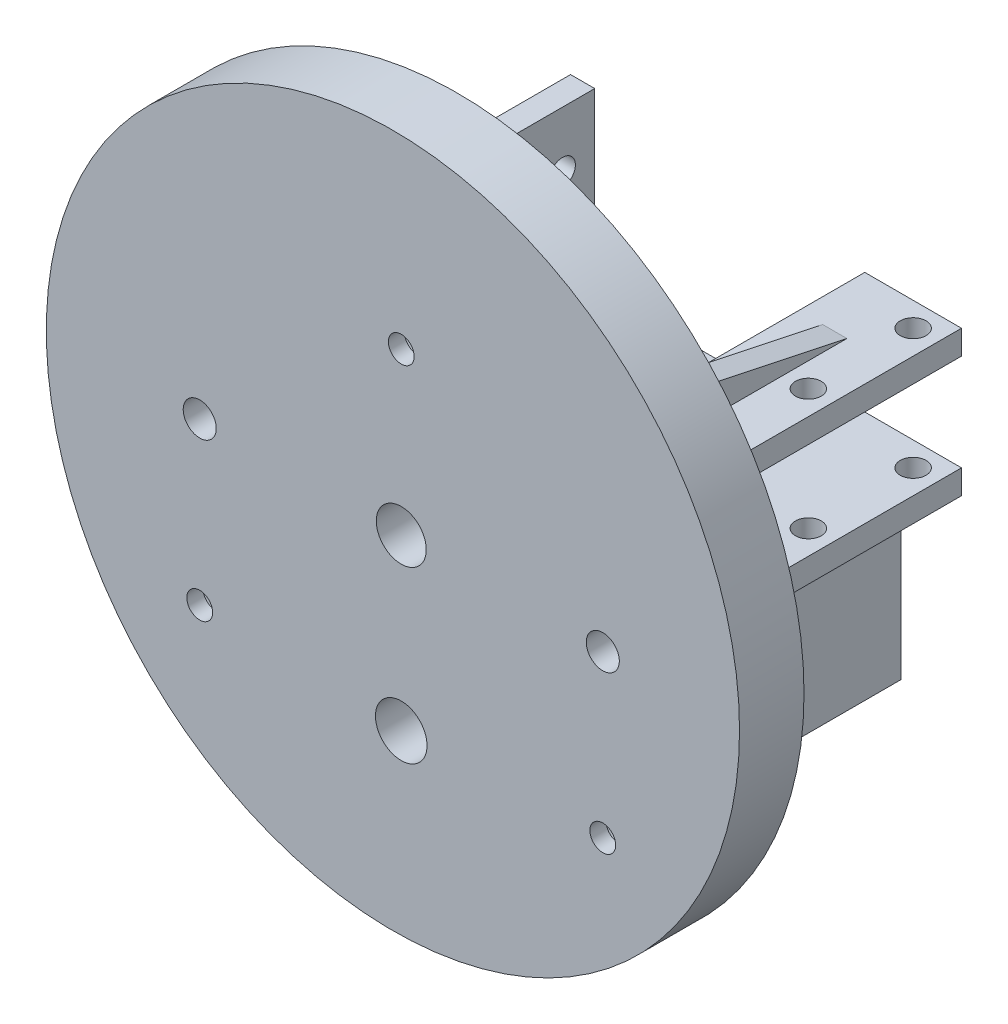
from build123d import *

# Parameters (mm, degrees)
SKETCH_1_R           = 21.5
EXTRUDE_1_DEPTH      = 4
SKETCH_2_R           = 1.55
CUT_EXTRUDE_1_DEPTH  = 32.032845297
SKETCH_3_R           = 1.025
CUT_EXTRUDE_4_DEPTH  = 32.032845297
SKETCH_3_3_R         = 2.5
CUT_EXTRUDE_5_DEPTH  = 3
SKETCH_4_R           = 0.8
CUT_EXTRUDE_6_DEPTH  = 32.032845297
SKETCH_5_R           = 1.6
CUT_EXTRUDE_7_DEPTH  = 32.032845297
CHAMFER_1_SIZE       = 0.5
SKETCH_6_W           = 14
SKETCH_6_H           = 11.5
SKETCH_6_W_2         = 12.5
SKETCH_6_H_2         = 10
EXTRUDE_2_DEPTH      = 20
CUT_EXTRUDE_8_DEPTH  = 49.060898735
SKETCH_9_W           = 1.5
SKETCH_9_H           = 13
SKETCH_9_H_2         = 6
EXTRUDE_3_DEPTH      = 16
SKETCH_10_R          = 0.8
CUT_EXTRUDE_9_DEPTH  = 48.343316459
SKETCH_11_W          = 6
SKETCH_11_H          = 1.5
EXTRUDE_4_DEPTH      = 20
SKETCH_12_R          = 0.8
CUT_EXTRUDE_10_DEPTH = 40.50680305
RIB_12_REACH         = 38.702
SKETCH_19_WALL_W     = 86.599014246
SKETCH_19_WALL_H     = 3
RIB_14_REACH         = 38.702
SKETCH_22_WALL_W     = 86.153478968
SKETCH_22_WALL_H     = 6
RIB_44_REACH         = 43.283
SKETCH_24_WALL_W     = 100.8135827
SKETCH_24_WALL_H     = 1.5
RIB_46_REACH         = 43.283
SKETCH_25_WALL_W     = 104.02522593
SKETCH_25_WALL_H     = 1


with BuildPart() as part:
    # 草图1 → 凸台-拉伸1 (new body)
    with BuildSketch(Plane.XY):
        with Locations((-0.517890163, 0)):
            Circle(SKETCH_1_R)
    extrude(amount=EXTRUDE_1_DEPTH)

    # 草图2 → 切除-拉伸1 (cut, through all)
    with BuildSketch(Plane(origin=(0, 0, 0), x_dir=(-1, 0, 0), z_dir=(0, 0, -1))):
        Circle(SKETCH_2_R)
    extrude(amount=-CUT_EXTRUDE_1_DEPTH, mode=Mode.SUBTRACT)

    # 草图3 → 切除-拉伸4 (cut, through all)
    with BuildSketch(Plane(origin=(0, 0, 0), x_dir=(-1, 0, 0), z_dir=(0, 0, -1))):
        with Locations((12.5, 0)):
            Circle(SKETCH_3_R)
        with Locations((-12.5, 0)):
            Circle(SKETCH_3_R)
    extrude(amount=-CUT_EXTRUDE_4_DEPTH, mode=Mode.SUBTRACT)

    # 草图3<3> → 切除-拉伸5 (cut)
    with BuildSketch(Plane(origin=(0, 0, 0), x_dir=(-1, 0, 0), z_dir=(0, 0, -1))):
        with Locations((0, 10)):
            Circle(SKETCH_3_3_R)
        with Locations((12.5, -10)):
            Circle(SKETCH_3_3_R)
        with Locations(Location((-12.5, -10, 0), (0, 0, 180))):
            Circle(SKETCH_3_3_R)
    extrude(amount=-CUT_EXTRUDE_5_DEPTH, mode=Mode.SUBTRACT)

    # 草图4 → 切除-拉伸6 (cut, through all)
    with BuildSketch(Plane(origin=(0, 0, 0), x_dir=(-1, 0, 0), z_dir=(0, 0, -1))):
        with Locations((0, 10)):
            Circle(SKETCH_4_R)
        with Locations((-12.5, -10)):
            Circle(SKETCH_4_R)
        with Locations((12.5, -10)):
            Circle(SKETCH_4_R)
    extrude(amount=-CUT_EXTRUDE_6_DEPTH, mode=Mode.SUBTRACT)

    # 草图5 → 切除-拉伸7 (cut, through all)
    with BuildSketch(Plane(origin=(0, 0, 0), x_dir=(-1, 0, 0), z_dir=(0, 0, -1))):
        with Locations((0, -10.5)):
            Circle(SKETCH_5_R)
    extrude(amount=-CUT_EXTRUDE_7_DEPTH, mode=Mode.SUBTRACT)

    # 倒角1
    chamfer_1_edges = [part.edges().sort_by_distance(p)[0] for p in [
        (1.6, -10.5, 0),
    ]]
    chamfer(chamfer_1_edges, length=CHAMFER_1_SIZE)

    # 草图6 → 凸台-拉伸2 (add)
    with BuildSketch(Plane(origin=(0, 0, 0), x_dir=(-1, 0, 0), z_dir=(0, 0, -1))):
        with Locations((0, -10.5)):
            Rectangle(SKETCH_6_W, SKETCH_6_H)
        with Locations((0, -10.5)):
            Rectangle(SKETCH_6_W_2, SKETCH_6_H_2, mode=Mode.SUBTRACT)
    extrude(amount=EXTRUDE_2_DEPTH)

    # 草图8 → 切除-拉伸8 (cut, through all)
    with BuildSketch(Plane.XZ.offset(16.25)):
        with BuildLine():
            Line((-4.789423927, -3.486509961), (4.789423927, -3.486509961))
            ThreePointArc((4.789423927, -3.486509961), (6.129674245, -4.826760278), (4.789423927, -6.167010596))
            Line((4.789423927, -6.167010596), (-4.789423927, -6.167010596))
            ThreePointArc((-4.789423927, -6.167010596), (-6.129674245, -4.826760278), (-4.789423927, -3.486509961))
        make_face()
        with BuildLine():
            Line((-4.789423927, -9.486509961), (4.789423927, -9.486509961))
            ThreePointArc((4.789423927, -9.486509961), (6.129674245, -10.826760278), (4.789423927, -12.167010596))
            Line((4.789423927, -12.167010596), (-4.789423927, -12.167010596))
            ThreePointArc((-4.789423927, -12.167010596), (-6.129674245, -10.826760278), (-4.789423927, -9.486509961))
        make_face()
        with BuildLine():
            Line((-4.789423927, -15.486509961), (4.789423927, -15.486509961))
            ThreePointArc((4.789423927, -15.486509961), (6.129674245, -16.826760278), (4.789423927, -18.167010596))
            Line((4.789423927, -18.167010596), (-4.789423927, -18.167010596))
            ThreePointArc((-4.789423927, -18.167010596), (-6.129674245, -16.826760278), (-4.789423927, -15.486509961))
        make_face()
    extrude(amount=-CUT_EXTRUDE_8_DEPTH, mode=Mode.SUBTRACT)

    # 草图9 → 凸台-拉伸3 (add)
    with BuildSketch(Plane(origin=(0, 0, 0), x_dir=(-1, 0, 0), z_dir=(0, 0, -1))):
        with Locations((8.75, 3.5)):
            Rectangle(SKETCH_9_W, SKETCH_9_H)
        with Locations((15.404659184, 0.121563114)):
            Rectangle(SKETCH_9_W, SKETCH_9_H_2)
    extrude(amount=EXTRUDE_3_DEPTH)

    # 草图10 → 切除-拉伸9 (cut, through all)
    with BuildSketch(Plane.ZY.offset(16.154659184)):
        with Locations(Location((-14, 0, 0), (0, 0, 90))):
            Circle(SKETCH_10_R)
        with Locations(Location((-14, 6.5, 0), (0, 0, 90))):
            Circle(SKETCH_10_R)
    extrude(amount=-CUT_EXTRUDE_9_DEPTH, mode=Mode.SUBTRACT)

    # 草图11 → 凸台-拉伸4 (add)
    with BuildSketch(Plane(origin=(0, 0, 0), x_dir=(-1, 0, 0), z_dir=(0, 0, -1))):
        with Locations((-7.75, -3.75)):
            Rectangle(SKETCH_11_W, SKETCH_11_H)
        with Locations((-7.75, 3.75)):
            Rectangle(SKETCH_11_W, SKETCH_11_H)
    extrude(amount=EXTRUDE_4_DEPTH)

    # 草图12 → 切除-拉伸10 (cut, through all)
    with BuildSketch(Plane(origin=(0, 4.5, 0), x_dir=(1, 0, 0), z_dir=(0, 1, 0))):
        with Locations(Location((9.25, 18.5, 0), (0, 0, 90))):
            Circle(SKETCH_12_R)
        with Locations(Location((9.25, 12, 0), (0, 0, 90))):
            Circle(SKETCH_12_R)
    extrude(amount=-CUT_EXTRUDE_10_DEPTH, mode=Mode.SUBTRACT)

    # 草图19 wall → 筋12 (add, up to next)
    with BuildSketch(Plane(origin=(-17.863127863, 0, -5.330395536), x_dir=(-0.305220070795, 0, 0.952281842935), z_dir=(0.952281842935, 0, 0.305220070795)), mode=Mode.PRIVATE) as rib_12_sk1:
        Rectangle(SKETCH_19_WALL_W, SKETCH_19_WALL_H)
    rib_12_tool1 = extrude(rib_12_sk1.sketch, amount=RIB_12_REACH, mode=Mode.PRIVATE) - part.part
    add(rib_12_tool1.solids().sort_by_distance((-17.863127863, 0, -5.330395536))[0])

    # 草图22 wall → 筋14 (add, up to next)
    with BuildSketch(Plane(origin=(-6.118778075, 0, -5.034752083), x_dir=(0.350012347277, 0, 0.936745086325), z_dir=(0.936745086325, 0, -0.350012347277)), mode=Mode.PRIVATE) as rib_14_sk1:
        with Locations((0, -3)):
            Rectangle(SKETCH_22_WALL_W, SKETCH_22_WALL_H)
    rib_14_tool1 = extrude(rib_14_sk1.sketch, amount=-RIB_14_REACH, mode=Mode.PRIVATE) - part.part
    add(rib_14_tool1.solids().sort_by_distance((-6.118778075, 0, -5.034752083))[0])

    # 草图24 wall → 筋44 (add, up to next)
    with BuildSketch(Plane(origin=(7, 6.186032175, -7.946880852), x_dir=(0, 0.20754310132, 0.978225874272), z_dir=(0, -0.978225874272, 0.20754310132)), mode=Mode.PRIVATE) as rib_44_sk1:
        Rectangle(SKETCH_24_WALL_W, SKETCH_24_WALL_H)
    rib_44_tool1 = extrude(rib_44_sk1.sketch, amount=RIB_44_REACH, mode=Mode.PRIVATE) - part.part
    add(rib_44_tool1.solids().sort_by_distance((7, 6.186032175, -7.946880852))[0])

    # 草图25 wall → 筋46 (add, up to next)
    with BuildSketch(Plane(origin=(7, -6.405254219, -9.541222999), x_dir=(0, -0.195820598306, 0.980639736743), z_dir=(0, -0.980639736743, -0.195820598306)), mode=Mode.PRIVATE) as rib_46_sk1:
        with Locations((0, -0.5)):
            Rectangle(SKETCH_25_WALL_W, SKETCH_25_WALL_H)
    rib_46_tool1 = extrude(rib_46_sk1.sketch, amount=-RIB_46_REACH, mode=Mode.PRIVATE) - part.part
    add(rib_46_tool1.solids().sort_by_distance((7, -6.405254219, -9.541222999))[0])


solid = part.part
